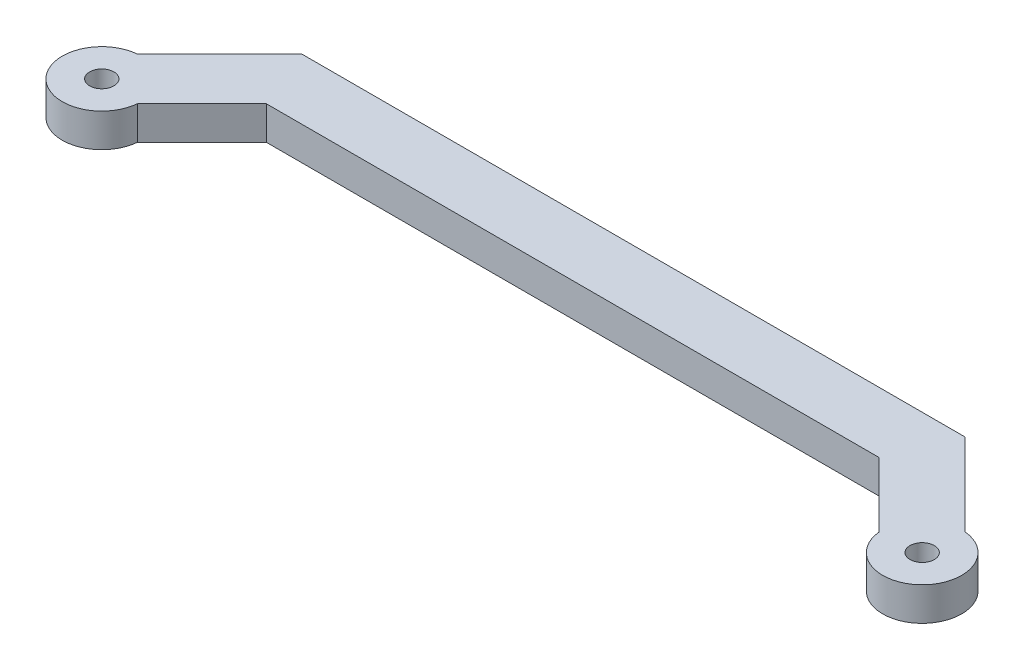
from build123d import *

# Parameters (mm, degrees)
SKETCH1_R           = 2
BOSS_EXTRUDE1_DEPTH = 5.5


with BuildPart() as part:
    # Sketch1 → Boss-Extrude1 (new body)
    with BuildSketch(Plane(origin=(0, 0, 0), x_dir=(1, 0, 0), z_dir=(0, 1, 0))):
        with BuildLine():
            Line((-50.428932188, 0), (50.428932188, 0))
            Line((50.428932188, 0), (61.027631063, -10.598698875))
            ThreePointArc((61.027631063, -10.598698875), (72.096194078, -14.596194078), (68.098698875, -3.527631063))
            Line((68.098698875, -3.527631063), (54.571067812, 10))
            Line((54.571067812, 10), (-54.571067812, 10))
            Line((-54.571067812, 10), (-68.098698875, -3.527631063))
            ThreePointArc((-68.098698875, -3.527631063), (-72.096194078, -14.596194078), (-61.027631063, -10.598698875))
            Line((-61.027631063, -10.598698875), (-50.428932188, 0))
        make_face()
        with Locations(Location((67.5, -10, 0), (0, 0, 270))):
            Circle(SKETCH1_R, mode=Mode.SUBTRACT)
        with Locations(Location((-67.5, -10, 0), (0, 0, 90))):
            Circle(SKETCH1_R, mode=Mode.SUBTRACT)
    extrude(amount=BOSS_EXTRUDE1_DEPTH)


solid = part.part
